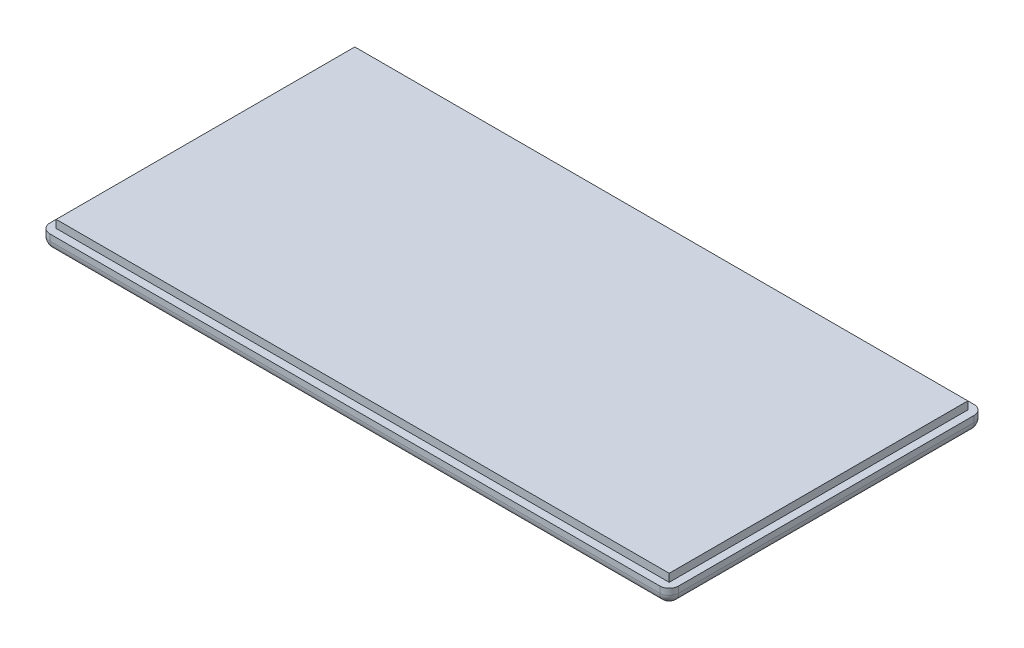
from build123d import *

# Parameters (mm, degrees)
SKETCH1_W           = 200
SKETCH1_H           = 100
BOSS_EXTRUDE1_DEPTH = 5
SKETCH2_W           = 195
SKETCH2_H           = 95
BOSS_EXTRUDE2_DEPTH = 2.5
FILLET1_R           = 3
FILLET2_R           = 3


with BuildPart() as part:
    # Sketch1 → Boss-Extrude1 (new body)
    with BuildSketch(Plane(origin=(0, 0, 0), x_dir=(1, 0, 0), z_dir=(0, 1, 0))):
        with Locations((100, -50)):
            Rectangle(SKETCH1_W, SKETCH1_H)
    extrude(amount=BOSS_EXTRUDE1_DEPTH)

    # Sketch2 → Boss-Extrude2 (add)
    with BuildSketch(Plane(origin=(0, 5, 0), x_dir=(1, 0, 0), z_dir=(0, 1, 0))):
        with Locations((100, -50)):
            Rectangle(SKETCH2_W, SKETCH2_H)
    extrude(amount=BOSS_EXTRUDE2_DEPTH)

    # Fillet1
    fillet1_edges = [part.edges().sort_by_distance(p)[0] for p in [
        (0, 2.5, 0),
        (200, 2.5, 0),
        (200, 2.5, 100),
        (0, 2.5, 100),
    ]]
    fillet(fillet1_edges, radius=FILLET1_R)

    # Fillet2
    fillet2_edges = [part.edges().sort_by_distance(p)[0] for p in [
        (200, 0, 50),
        (0, 0, 50),
        (100, 0, 0),
        (100, 0, 100),
        (0.878679656, 0, 99.121320344),
        (0.878679656, 0, 0.878679656),
        (199.121320344, 0, 0.878679656),
        (199.121320344, 0, 99.121320344),
    ]]
    fillet(fillet2_edges, radius=FILLET2_R)


solid = part.part
